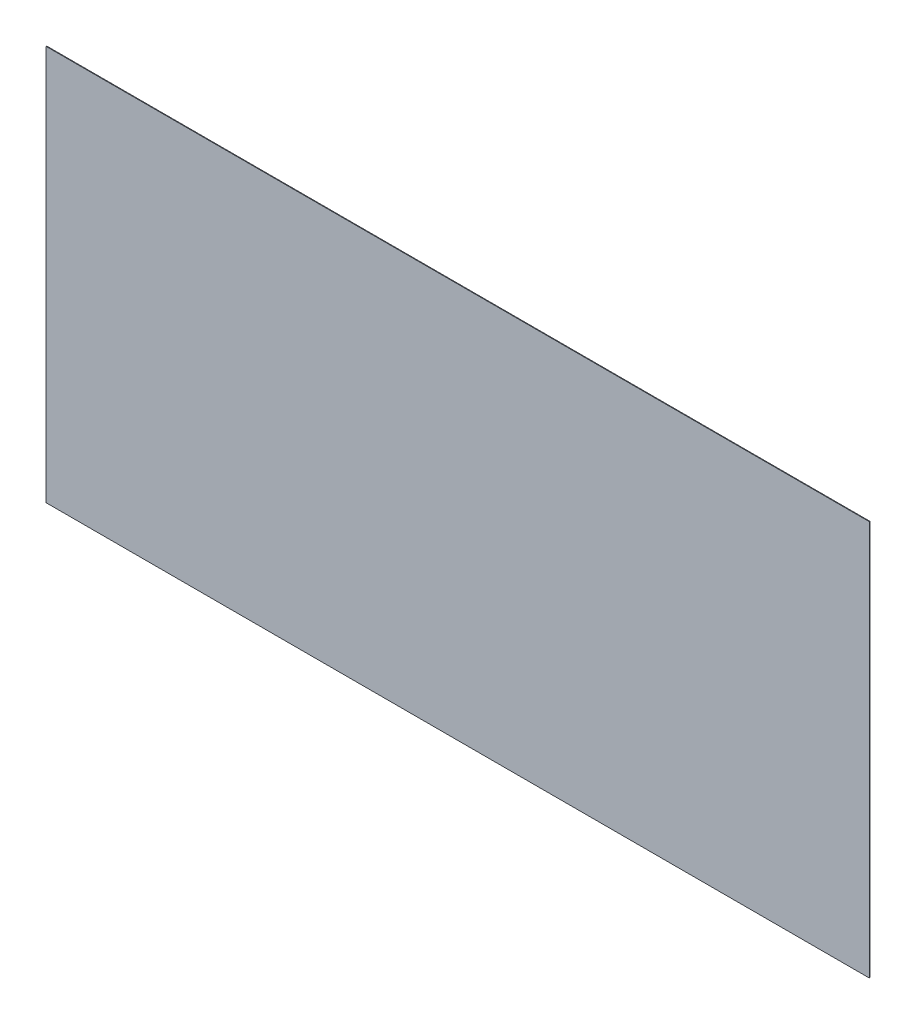
from build123d import *

# Parameters (mm, degrees)
CROQUIS1_W              = 1200
CROQUIS1_H              = 576.2
SALIENTE_EXTRUIR1_DEPTH = 0.9


with BuildPart() as part:
    # Croquis1 → Saliente-Extruir1 (new body)
    with BuildSketch(Plane.XY):
        Rectangle(CROQUIS1_W, CROQUIS1_H)
    extrude(amount=SALIENTE_EXTRUIR1_DEPTH)


solid = part.part
